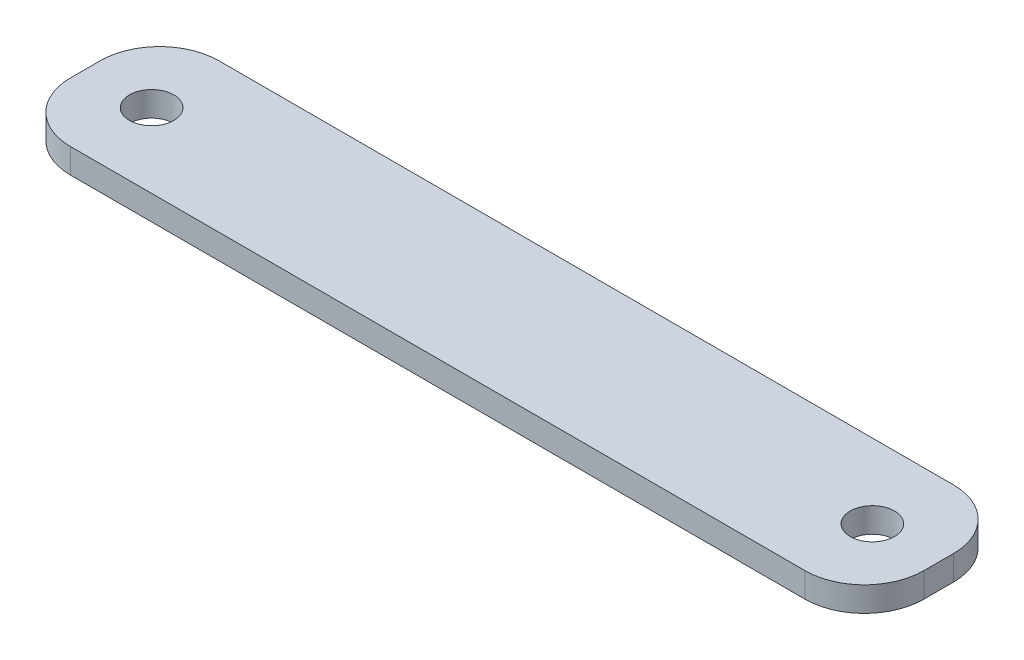
from build123d import *

# Parameters (mm, degrees)
SKETCH1_W           = 54.737
SKETCH1_H           = 9.525
BOSS_EXTRUDE1_DEPTH = 1.5875
FILLET1_R           = 3.81
SKETCH2_R           = 1.4224
CUT_EXTRUDE1_DEPTH  = 56.582235923


with BuildPart() as part:
    # Sketch1 → Boss-Extrude1 (new body)
    with BuildSketch(Plane(origin=(0, 0, 0), x_dir=(1, 0, 0), z_dir=(0, 1, 0))):
        with Locations((27.3685, 4.7625)):
            Rectangle(SKETCH1_W, SKETCH1_H)
    extrude(amount=BOSS_EXTRUDE1_DEPTH)

    # Fillet1
    fillet1_edges = [part.edges().sort_by_distance(p)[0] for p in [
        (0, 0.79375, -9.525),
        (54.737, 0.79375, -9.525),
        (54.737, 0.79375, 0),
        (0, 0.79375, 0),
    ]]
    fillet(fillet1_edges, radius=FILLET1_R)

    # Sketch2 → Cut-Extrude1 (cut, through all)
    with BuildSketch(Plane(origin=(0, 1.5875, 0), x_dir=(1, 0, 0), z_dir=(0, 1, 0))):
        with Locations(Location((4.2545, 4.7625, 0), (0, 0, 270))):
            Circle(SKETCH2_R)
        with Locations(Location((50.4825, 4.7625, 0), (0, 0, 270))):
            Circle(SKETCH2_R)
    extrude(amount=-CUT_EXTRUDE1_DEPTH, mode=Mode.SUBTRACT)


solid = part.part
